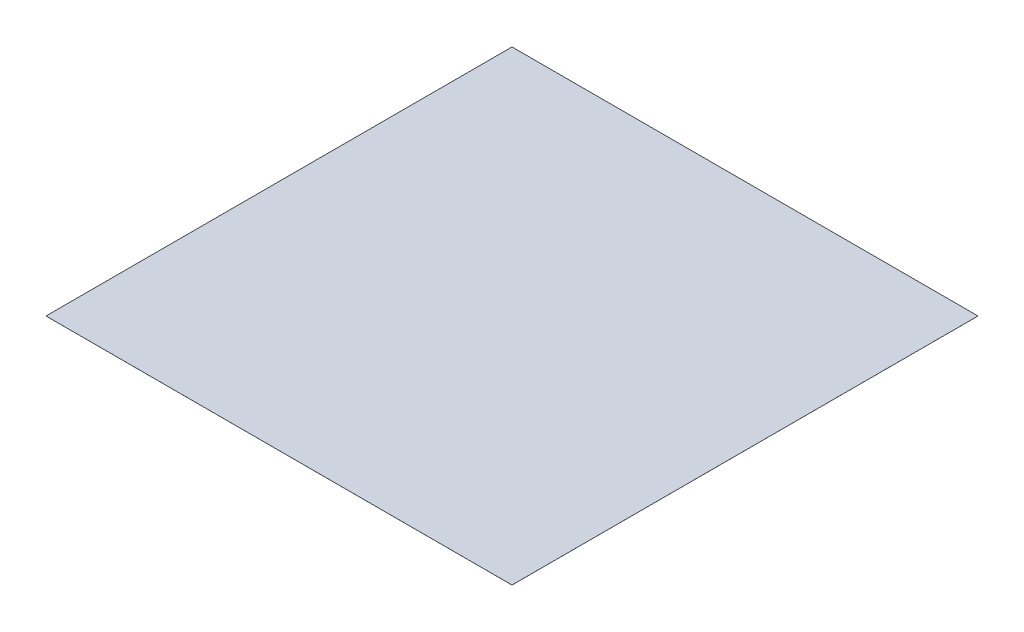
from build123d import *

# Parameters (mm, degrees)
SKETCH1_W           = 200
SKETCH1_H           = 200
BOSS_EXTRUDE1_DEPTH = 0.01


with BuildPart() as part:
    # Sketch1 → Boss-Extrude1 (new body)
    with BuildSketch(Plane(origin=(0, 0, 0), x_dir=(1, 0, 0), z_dir=(0, 1, 0))):
        Rectangle(SKETCH1_W, SKETCH1_H)
    extrude(amount=BOSS_EXTRUDE1_DEPTH)


solid = part.part
